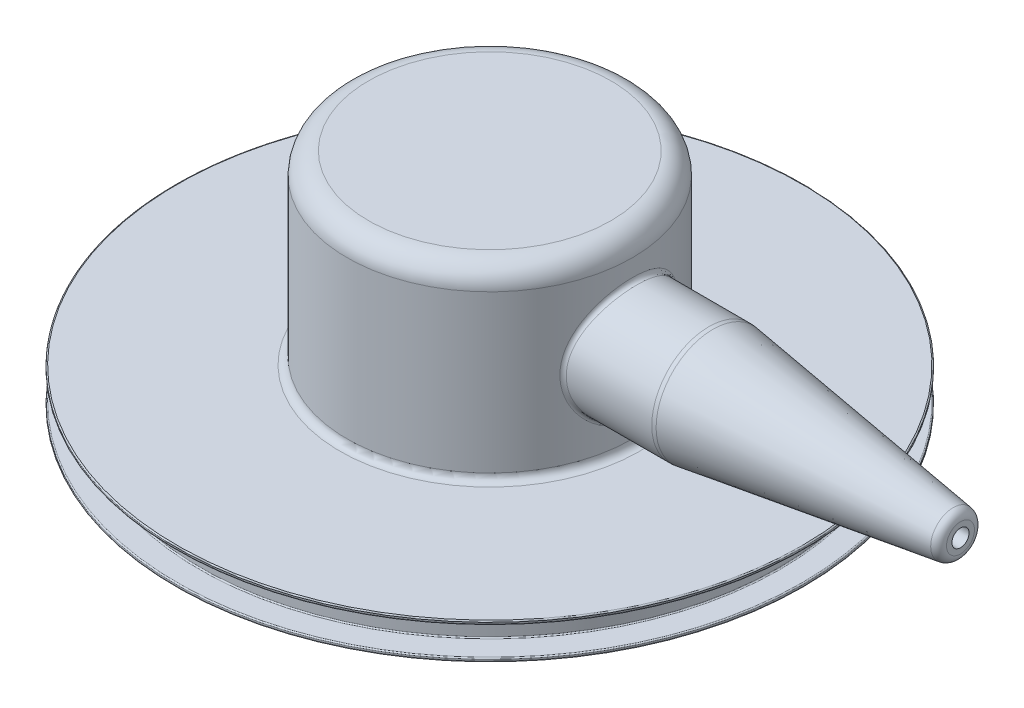
from build123d import *

# Parameters (mm, degrees)
SKETCH3_R               = 4
BOSS_EXTRUDE1_DEPTH     = 25
BOSS_EXTRUDE2_START     = 25
SKETCH3_5_R             = 3
BOSS_EXTRUDE2_DEPTH     = 8
CUT_EXTRUDE1_DEPTH      = 11.8
CUT_EXTRUDE1_DEPTH_BACK = 43.766809598
SKETCH15_R              = 1.8
FILLET1_R               = 0.5
FILLET2_R               = 0.3
FILLET3_R               = 2
FILLET4_R               = 1.5
FILLET5_R               = 0.5
FILLET6_R               = 0.08
FILLET7_R               = 0.08
FILLET8_R               = 0.6


with BuildPart() as part:
    # Sketch1 → Revolve1 (revolve)
    with BuildSketch(Plane.XY, mode=Mode.PRIVATE) as revolve1_sk:
        Polygon((0, 16), (0, 0), (19, 0), (22, 0.5), (22, 0.75), (20.274769741, 0.75), (20.274769741, 2.75), (22, 2.75), (22, 3), (10, 3), (10, 16), align=None)
    revolve(revolve1_sk.sketch.rotate(Axis((0, 16, 0), (0, -1, 0)), 180), axis=Axis((0, 16, 0), (0, -1, 0)))

    # Sketch3 → Boss-Extrude1 (add)
    with BuildSketch(Plane(origin=(0, 0, 0), x_dir=(0, 0, -1), z_dir=(1, 0, 0))):
        with Locations(Location((0, 9, 0), (0, 0, 180))):
            Circle(SKETCH3_R)
    extrude(amount=BOSS_EXTRUDE1_DEPTH)

    # Sketch3<5> → Boss-Extrude2 (add)
    with BuildSketch(Plane(origin=(0, 0, 0), x_dir=(0, 0, -1), z_dir=(1, 0, 0)).offset(BOSS_EXTRUDE2_START)):
        with Locations((0, 9)):
            Circle(SKETCH3_5_R)
    extrude(amount=BOSS_EXTRUDE2_DEPTH)

    # Sketch11 → Cut-Revolve10 (revolve, cut)
    with BuildSketch(Plane.XY):
        with BuildLine():
            Line((0, 4), (0, 0))
            Line((0, 0), (19, 0))
            ThreePointArc((19, 0), (9.694745388, 2.925040595), (0, 4))
        make_face()
    revolve(axis=Axis((0, 0, 0), (0, 1, 0)), mode=Mode.SUBTRACT)

    # Sketch15 → Cut-Extrude1 (cut, two sides: drawn at the far end of the back side and taken through both)
    with BuildSketch(Plane(origin=(0, 0, 0), x_dir=(1, 0, 0), z_dir=(0, 1, 0)).offset(-CUT_EXTRUDE1_DEPTH_BACK)):
        with Locations(Location((0, 0, 0), (0, 0, 270))):
            Circle(SKETCH15_R)
    extrude(amount=CUT_EXTRUDE1_DEPTH + CUT_EXTRUDE1_DEPTH_BACK, mode=Mode.SUBTRACT)

    # Sketch19 → Cut-Revolve14 (revolve, cut)
    with BuildSketch(Plane.XY, mode=Mode.PRIVATE) as cut_revolve14_sk:
        Polygon((33, 13), (15.5, 13), (33, 10.5), align=None)
    revolve(cut_revolve14_sk.sketch.rotate(Axis((33, 9, 0), (1, 0, 0)), 90), axis=Axis((33, 9, 0), (1, 0, 0)), mode=Mode.SUBTRACT)

    # Sketch17 → Cut-Revolve13 (revolve, cut)
    with BuildSketch(Plane.XY, mode=Mode.PRIVATE) as cut_revolve13_sk:
        Polygon((33, 9.6), (33, 9), (1.802729675, 9), (1.802729675, 11.8), (15.503373698, 11.8), (30.900404844, 9.6), align=None)
    revolve(cut_revolve13_sk.sketch.rotate(Axis((1.802729675, 9, 0), (1, 0, 0)), 180), axis=Axis((1.802729675, 9, 0), (1, 0, 0)), mode=Mode.SUBTRACT)

    # Fillet1
    fillet1_edges = [part.edges().sort_by_distance(p)[0] for p in [
        (10, 3, 0),
    ]]
    fillet(fillet1_edges, radius=FILLET1_R)

    # Fillet2
    fillet2_edges = [part.edges().sort_by_distance(p)[0] for p in [
        (9.16515139, 9, -4),
    ]]
    fillet(fillet2_edges, radius=FILLET2_R)

    # Fillet3
    fillet3_edges = [part.edges().sort_by_distance(p)[0] for p in [
        (15.5, 9, -4),
    ]]
    fillet(fillet3_edges, radius=FILLET3_R)

    # Fillet4
    fillet4_edges = [part.edges().sort_by_distance(p)[0] for p in [
        (10, 16, 0),
    ]]
    fillet(fillet4_edges, radius=FILLET4_R)

    # Fillet5
    fillet5_edges = [part.edges().sort_by_distance(p)[0] for p in [
        (0, 0, -19),
    ]]
    fillet(fillet5_edges, radius=FILLET5_R)

    # Fillet6
    fillet6_edges = [part.edges().sort_by_distance(p)[0] for p in [
        (20.274769741, 0.75, 0),
        (22, 0.75, 0),
        (22, 0.5, 0),
        (22, 3, 0),
        (22, 2.75, 0),
        (20.274769741, 2.75, 0),
    ]]
    fillet(fillet6_edges, radius=FILLET6_R)

    # Fillet7
    fillet7_edges = [part.edges().sort_by_distance(p)[0] for p in [
        (-1.272792206, 3.943719446, -1.272792206),
    ]]
    fillet(fillet7_edges, radius=FILLET7_R)

    # Fillet8
    fillet8_edges = [part.edges().sort_by_distance(p)[0] for p in [
        (33, 9, -1.5),
    ]]
    fillet(fillet8_edges, radius=FILLET8_R)


solid = part.part
